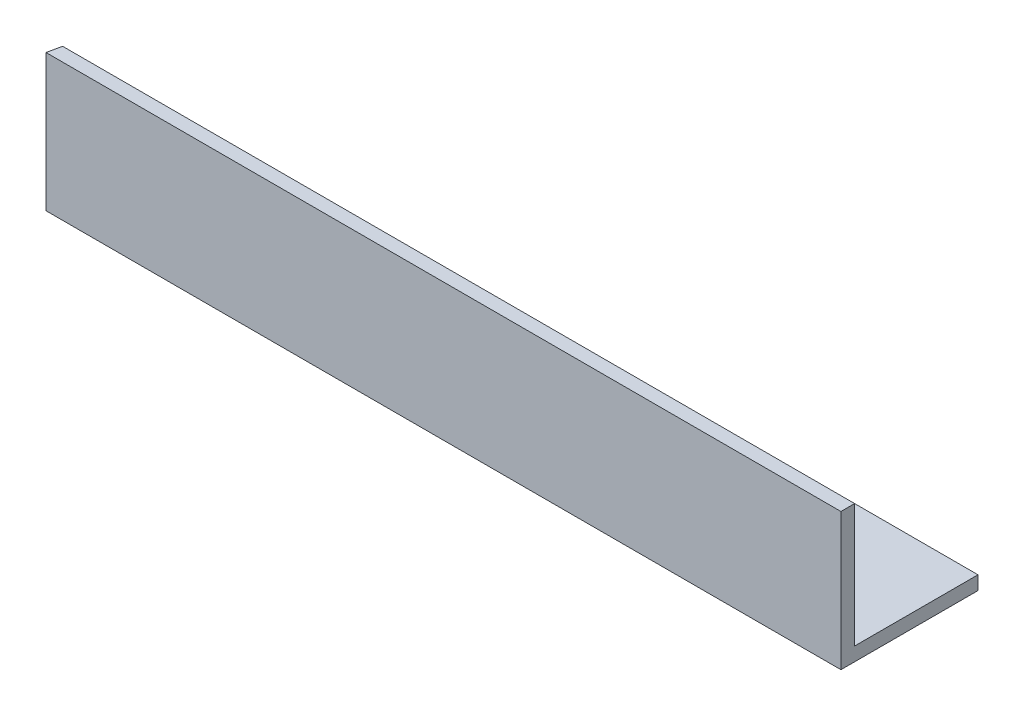
from build123d import *

# Parameters (mm, degrees)
BOSS_EXTRUDE1_DEPTH = 116
CUT_EXTRUDE1_DEPTH  = 120.398492453


with BuildPart() as part:
    # Sketch1 → Boss-Extrude1 (new body)
    with BuildSketch(Plane(origin=(0, 0, 0), x_dir=(0, 0, -1), z_dir=(1, 0, 0))):
        Polygon((0, 20), (0, 0), (20, 0), (20, 2), (2, 2), (2, 20), align=None)
    extrude(amount=BOSS_EXTRUDE1_DEPTH)

    # Sketch2 → Cut-Extrude1 (cut, through all)
    with BuildSketch(Plane.XZ):
        Polygon((0, 0), (4.251131233, -20), (0, -20), align=None)
    extrude(amount=-CUT_EXTRUDE1_DEPTH, mode=Mode.SUBTRACT)


solid = part.part
